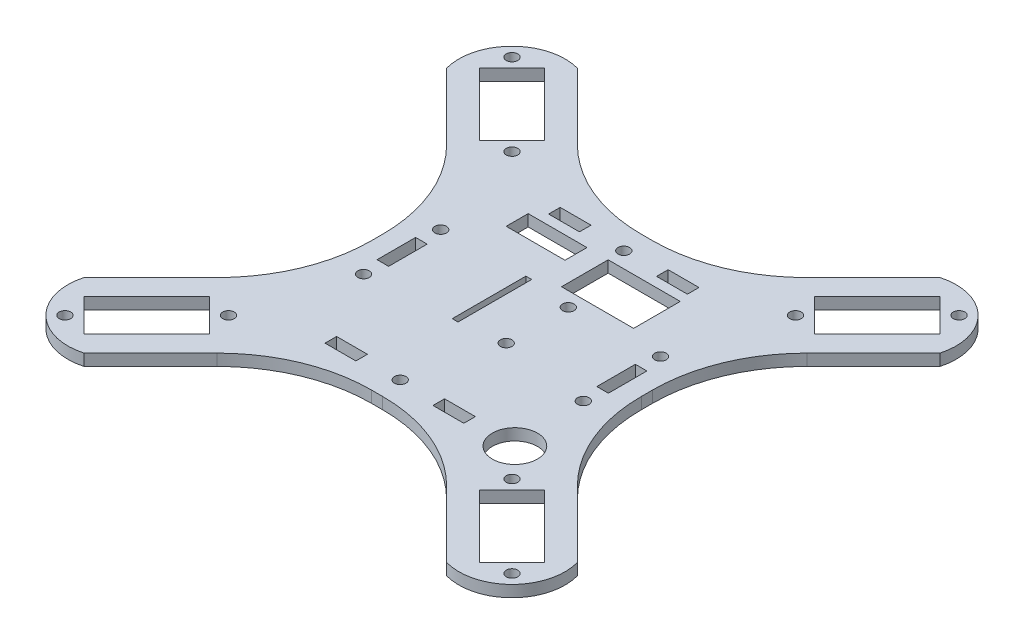
from build123d import *

# Parameters (mm, degrees)
ESBO_O1_R                = 1.5
ESBO_O1_R_2              = 5.85
ESBO_O1_W                = 3
ESBO_O1_H                = 10
ESBO_O1_W_2              = 8
ESBO_O1_H_2              = 3
ESBO_O1_W_3              = 15.25
ESBO_O1_H_3              = 5.7
ESBO_O1_W_4              = 18.7
ESBO_O1_H_4              = 12.1
RESSALTO_EXTRUS_O1_DEPTH = 3


with BuildPart() as part:
    # Esboço1 → Ressalto-extrusão1 (new body)
    with BuildSketch(Plane(origin=(0, 0, 0), x_dir=(1, 0, 0), z_dir=(0, 1, 0))):
        with BuildLine():
            Line((110.386890532, 33), (113.308680045, 33))
            ThreePointArc((113.308680045, 33), (128.61601734, 36.0448187), (141.592951292, 44.715728753))
            Line((141.592951292, 44.715728753), (158.868600568, 61.991378029))
            ThreePointArc((158.868600568, 61.991378029), (172.303629411, 58.455844123), (175.839163317, 45.02081528))
            Line((175.839163317, 45.02081528), (158.563514041, 27.745166004))
            ThreePointArc((158.563514041, 27.745166004), (149.892603988, 14.768232051), (146.847785288, -0.539105243))
            Line((146.847785288, -0.539105243), (146.847785288, -3.460894757))
            ThreePointArc((146.847785288, -3.460894757), (149.892603988, -18.768232051), (158.563514041, -31.745166004))
            Line((158.563514041, -31.745166004), (175.839163317, -49.02081528))
            ThreePointArc((175.839163317, -49.02081528), (172.303629411, -62.455844123), (158.868600568, -65.991378029))
            Line((158.868600568, -65.991378029), (141.592951292, -48.715728753))
            ThreePointArc((141.592951292, -48.715728753), (128.61601734, -40.0448187), (113.308680045, -37))
            Line((113.308680045, -37), (110.386890532, -37))
            ThreePointArc((110.386890532, -37), (95.079553237, -40.0448187), (82.102619284, -48.715728753))
            Line((82.102619284, -48.715728753), (64.826970008, -65.991378029))
            ThreePointArc((64.826970008, -65.991378029), (51.391941166, -62.455844123), (47.85640726, -49.02081528))
            Line((47.85640726, -49.02081528), (65.132056536, -31.745166004))
            ThreePointArc((65.132056536, -31.745166004), (73.802966589, -18.768232051), (76.847785288, -3.460894757))
            Line((76.847785288, -3.460894757), (76.847785288, -0.539105243))
            ThreePointArc((76.847785288, -0.539105243), (73.802966589, 14.768232051), (65.132056536, 27.745166004))
            Line((65.132056536, 27.745166004), (47.85640726, 45.02081528))
            ThreePointArc((47.85640726, 45.02081528), (51.391941166, 58.455844123), (64.826970008, 61.991378029))
            Line((64.826970008, 61.991378029), (82.102619284, 44.715728753))
            ThreePointArc((82.102619284, 44.715728753), (95.079553237, 36.0448187), (110.386890532, 33))
        make_face()
        with Locations(Location((111.847785288, 27, 0), (0, 0, 270))):
            Circle(ESBO_O1_R, mode=Mode.SUBTRACT)
        with Locations(Location((111.847785288, -31, 0), (0, 0, 270))):
            Circle(ESBO_O1_R, mode=Mode.SUBTRACT)
        with Locations(Location((169.828664477, -59.980879188, 0), (0, 0, 270))):
            Circle(ESBO_O1_R, mode=Mode.SUBTRACT)
        with Locations(Location((148.615552241, -38.767766953, 0), (0, 0, 270))):
            Circle(ESBO_O1_R, mode=Mode.SUBTRACT)
        with Locations(Location((148.615552241, 34.767766953, 0), (0, 0, 270))):
            Circle(ESBO_O1_R, mode=Mode.SUBTRACT)
        with Locations(Location((169.828664477, 55.980879188, 0), (0, 0, 270))):
            Circle(ESBO_O1_R, mode=Mode.SUBTRACT)
        with Locations(Location((75.080018335, 34.767766953, 0), (0, 0, 270))):
            Circle(ESBO_O1_R, mode=Mode.SUBTRACT)
        with Locations(Location((53.8669061, 55.980879188, 0), (0, 0, 270))):
            Circle(ESBO_O1_R, mode=Mode.SUBTRACT)
        with Locations(Location((117.347785288, 7.1, 0), (0, 0, 270))):
            Circle(ESBO_O1_R, mode=Mode.SUBTRACT)
        with Locations(Location((53.8669061, -59.980879188, 0), (0, 0, 270))):
            Circle(ESBO_O1_R, mode=Mode.SUBTRACT)
        with Locations(Location((75.080018335, -38.767766953, 0), (0, 0, 270))):
            Circle(ESBO_O1_R, mode=Mode.SUBTRACT)
        with Locations(Location((117.347785288, -9, 0), (0, 0, 270))):
            Circle(ESBO_O1_R, mode=Mode.SUBTRACT)
        with Locations(Location((83.347785288, 8, 0), (0, 0, 270))):
            Circle(ESBO_O1_R, mode=Mode.SUBTRACT)
        with Locations(Location((83.347785288, -12, 0), (0, 0, 270))):
            Circle(ESBO_O1_R, mode=Mode.SUBTRACT)
        with Locations(Location((140.347785288, 8, 0), (0, 0, 270))):
            Circle(ESBO_O1_R, mode=Mode.SUBTRACT)
        with Locations(Location((140.347785288, -12, 0), (0, 0, 270))):
            Circle(ESBO_O1_R, mode=Mode.SUBTRACT)
        with Locations(Location((141.592951292, -31, 0), (0, 0, 270))):
            Circle(ESBO_O1_R_2, mode=Mode.SUBTRACT)
        with Locations((83.347785288, -2)):
            Rectangle(ESBO_O1_W, ESBO_O1_H, mode=Mode.SUBTRACT)
        with Locations((125.847785288, -31)):
            Rectangle(ESBO_O1_W_2, ESBO_O1_H_2, mode=Mode.SUBTRACT)
        with Locations((140.347785288, -2)):
            Rectangle(ESBO_O1_W, ESBO_O1_H, mode=Mode.SUBTRACT)
        with Locations((97.847785288, -31)):
            Rectangle(ESBO_O1_W_2, ESBO_O1_H_2, mode=Mode.SUBTRACT)
        with Locations((97.847785288, 27)):
            Rectangle(ESBO_O1_W_2, ESBO_O1_H_2, mode=Mode.SUBTRACT)
        with Locations((98.722785288, 20.094707965)):
            Rectangle(ESBO_O1_W_3, ESBO_O1_H_3, mode=Mode.SUBTRACT)
        with Locations((125.847785288, 27)):
            Rectangle(ESBO_O1_W_2, ESBO_O1_H_2, mode=Mode.SUBTRACT)
        with Locations((121.197785288, 16.894707965)):
            Rectangle(ESBO_O1_W_4, ESBO_O1_H_4, mode=Mode.SUBTRACT)
        Polygon((165.603972833, -59.256005764), (169.121648896, -55.738329701), (171.59652263, -53.263455967), (163.464794646, -45.131727984), (155.333066663, -37), (146.847785288, -45.485281374), (163.111241256, -61.748737342), align=None, mode=Mode.SUBTRACT)
        Polygon((163.464794646, 41.131727984), (155.333066663, 33), (146.847785288, 41.485281374), (163.111241256, 57.748737342), (165.603972833, 55.256005764), (169.121648896, 51.738329701), (171.59652263, 49.263455967), align=None, mode=Mode.SUBTRACT)
        Polygon((104.847785288, 8.6), (104.847785288, -10.5), (106.347785288, -10.5), (106.347785288, 7.873666298), (106.347785288, 8.6), align=None, mode=Mode.SUBTRACT)
        Polygon((68.716057305, 49.617009358), (76.847785288, 41.485281374), (68.362503914, 33), (52.099047947, 49.263455967), (54.591779524, 51.756187545), (58.109455587, 55.273863607), (60.584329321, 57.748737342), align=None, mode=Mode.SUBTRACT)
        Polygon((54.591779524, -55.756187545), (58.109455587, -59.273863607), (60.584329321, -61.748737342), (68.716057305, -53.617009358), (76.847785288, -45.485281374), (68.362503914, -37), (52.099047947, -53.263455967), align=None, mode=Mode.SUBTRACT)
    extrude(amount=RESSALTO_EXTRUS_O1_DEPTH)


solid = part.part
